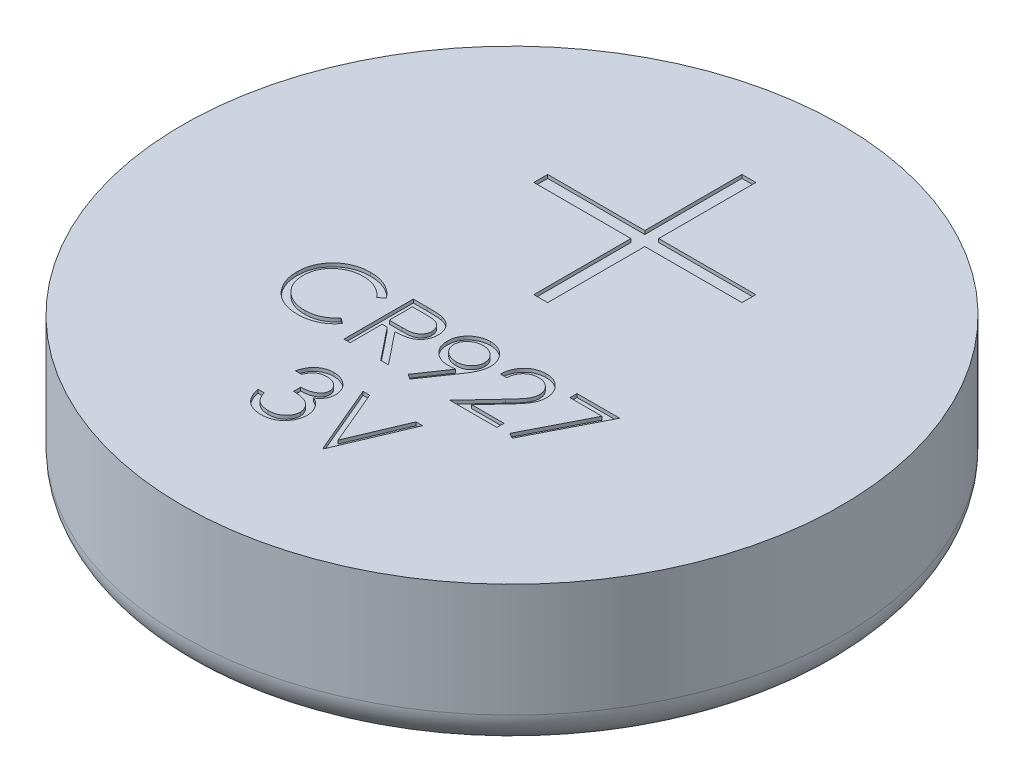
from build123d import *

# Parameters (mm, degrees)
SKETCH1_R           = 4.75
BOSS_EXTRUDE1_DEPTH = 2.7
SKETCH2_R           = 4.75
SKETCH2_R_2         = 3.6449
CUT_EXTRUDE1_DEPTH  = 0.5664
FILLET1_R           = 0.5
FILLET2_R           = 0.2
SKETCH3_R           = 4.25
SKETCH3_R_2         = 3.6449
CUT_EXTRUDE2_DEPTH  = 0.15
CUT_EXTRUDE4_DEPTH  = 0.05
SKETCH6_W           = 1.4
SKETCH6_H           = 0.2
SKETCH6_W_2         = 0.2
SKETCH6_H_2         = 1.4
CUT_EXTRUDE5_DEPTH  = 0.05


with BuildPart() as part:
    # Sketch1 → Boss-Extrude1 (new body)
    with BuildSketch(Plane(origin=(0, 0, 0), x_dir=(1, 0, 0), z_dir=(0, 1, 0))):
        with Locations(Location((0, 0, 0), (0, 0, 90))):
            Circle(SKETCH1_R)
    extrude(amount=BOSS_EXTRUDE1_DEPTH)

    # Sketch2 → Cut-Extrude1 (cut)
    with BuildSketch(Plane.XZ):
        with Locations(Location((0, 0, 0), (0, 0, 270))):
            Circle(SKETCH2_R)
        with Locations(Location((0, 0, 0), (0, 0, 270))):
            Circle(SKETCH2_R_2, mode=Mode.SUBTRACT)
    extrude(amount=-CUT_EXTRUDE1_DEPTH, mode=Mode.SUBTRACT)

    # Fillet1
    fillet1_edges = [part.edges().sort_by_distance(p)[0] for p in [
        (0, 0.5664, 4.75),
    ]]
    fillet(fillet1_edges, radius=FILLET1_R)

    # Fillet2
    fillet2_edges = [part.edges().sort_by_distance(p)[0] for p in [
        (0, 0, 3.6449),
    ]]
    fillet(fillet2_edges, radius=FILLET2_R)

    # Sketch3 → Cut-Extrude2 (cut)
    with BuildSketch(Plane.XZ.offset(-0.5664)):
        with Locations(Location((0, 0, 0), (0, 0, 270))):
            Circle(SKETCH3_R)
        with Locations(Location((0, 0, 0), (0, 0, 270))):
            Circle(SKETCH3_R_2, mode=Mode.SUBTRACT)
    extrude(amount=-CUT_EXTRUDE2_DEPTH, mode=Mode.SUBTRACT)

    # Sketch5 → Cut-Extrude4 (cut)
    # profile 1 of 7: a face of its own
    with BuildSketch(Plane(origin=(0, 2.7, 0), x_dir=(1, 0, 0), z_dir=(0, 1, 0))):
        with BuildLine():
            Line((-1.118097587, -0.693010986), (-1.196623228, -0.75310714))
            add(Edge.make_bspline(
                [(-1.196623228, -0.75310714), (-1.20222491, -0.746431149), (-1.213352752, -0.733169173), (-1.231255381, -0.714546446), (-1.249912994, -0.697099228), (-1.269318457, -0.680744405), (-1.289821062, -0.666053901), (-1.310924148, -0.652262157), (-1.332980732, -0.639899946), (-1.363481228, -0.624910522), (-1.403380613, -0.609268763), (-1.45360771, -0.596153554), (-1.506039452, -0.587804647), (-1.541810195, -0.586900407), (-1.560004638, -0.586440473)],
                knots=[0, 0, 0, 0, 0.757959112, 1.505699292, 2.245454638, 2.979532153, 3.711538275, 4.438200793, 5.171680507, 5.909471876, 7.393775596, 8.890124382, 10.418191784, 12, 12, 12, 12], degree=3))
            add(Edge.make_bspline(
                [(-1.560004638, -0.586440473), (-1.570028438, -0.586555891), (-1.589983007, -0.586785656), (-1.619596857, -0.589816834), (-1.648657728, -0.59407718), (-1.677146719, -0.600398701), (-1.705027564, -0.608390878), (-1.732482536, -0.617940996), (-1.759114136, -0.629756665), (-1.785290776, -0.642816168), (-1.81037055, -0.657566866), (-1.834100564, -0.673656395), (-1.856394269, -0.690904708), (-1.877269301, -0.709376453), (-1.896747, -0.728988442), (-1.914686232, -0.749949682), (-1.931024921, -0.77219316), (-1.946086928, -0.795425563), (-1.95957628, -0.819579217), (-1.970870532, -0.844743523), (-1.980871995, -0.870487553), (-1.988786064, -0.89710217), (-1.995050212, -0.924400103), (-1.999372402, -0.952454614), (-2.002369108, -0.981207094), (-2.00259773, -1.000695469), (-2.002712971, -1.010518999)],
                knots=[0, 0, 0, 0, 1.054917814, 2.100044995, 3.131103042, 4.146048494, 5.169673617, 6.183595914, 7.203665975, 8.234915748, 9.262203917, 10.264457458, 11.251630812, 12.227803204, 13.197192746, 14.159520551, 15.12972552, 16.100847026, 17.073214652, 18.039054194, 19.002613845, 19.979014051, 20.95965708, 21.949030935, 22.966165397, 24, 24, 24, 24], degree=3))
            add(Edge.make_bspline(
                [(-2.002712971, -1.010518999), (-2.002352452, -1.025299376), (-2.001644619, -1.054318686), (-1.995345095, -1.096824575), (-1.985772212, -1.137544767), (-1.971424904, -1.176224722), (-1.953733747, -1.213341396), (-1.931379286, -1.248266783), (-1.905488847, -1.281528658), (-1.875696156, -1.312340929), (-1.84300878, -1.340487708), (-1.807937948, -1.365273588), (-1.770571009, -1.385934983), (-1.731320543, -1.403128111), (-1.68988451, -1.416344319), (-1.646337424, -1.425648354), (-1.600773997, -1.431717548), (-1.569639882, -1.432298602), (-1.553794702, -1.43259432)],
                knots=[0, 0, 0, 0, 1.029171465, 2.020641659, 2.987623507, 3.938342917, 4.889210282, 5.84687017, 6.821220943, 7.821438502, 8.827599549, 9.822697543, 10.807740252, 11.797342354, 12.80366471, 13.83203677, 14.896651826, 16, 16, 16, 16], degree=3))
            add(Edge.make_bspline(
                [(-1.553794702, -1.43259432), (-1.536336791, -1.432111811), (-1.501975446, -1.431162119), (-1.451584581, -1.423116619), (-1.403345791, -1.4100715), (-1.35725648, -1.39181495), (-1.313446581, -1.368082011), (-1.271847536, -1.339311189), (-1.23242423, -1.305228808), (-1.208718149, -1.279205057), (-1.196623228, -1.265927653)],
                knots=[0, 0, 0, 0, 1.028121516, 2.023589091, 2.998037872, 3.967518031, 4.937445131, 5.927275754, 6.942489185, 8, 8, 8, 8], degree=3))
            Line((-1.196623228, -1.265927653), (-1.118097587, -1.325422845))
            add(Edge.make_bspline(
                [(-1.118097587, -1.325422845), (-1.124417047, -1.333576689), (-1.137025697, -1.349845319), (-1.157442273, -1.372780093), (-1.178950072, -1.394352675), (-1.201708847, -1.414389138), (-1.225456787, -1.433290414), (-1.250620305, -1.450519508), (-1.2768686, -1.466316904), (-1.304112737, -1.48078174), (-1.332323769, -1.493615239), (-1.361467893, -1.504602029), (-1.391419486, -1.514066284), (-1.422179917, -1.521852551), (-1.453812991, -1.527930004), (-1.486204555, -1.531992768), (-1.519424519, -1.534776172), (-1.541836354, -1.535029862), (-1.553193741, -1.535158422)],
                knots=[0, 0, 0, 0, 0.986787822, 1.968848986, 2.935600012, 3.899624008, 4.868462664, 5.837806735, 6.815139263, 7.798259679, 8.787526145, 9.778297419, 10.776456485, 11.791383307, 12.812564526, 13.85620153, 14.913611965, 16, 16, 16, 16], degree=3))
            add(Edge.make_bspline(
                [(-1.553193741, -1.535158422), (-1.563949074, -1.535083567), (-1.585216414, -1.534935551), (-1.616616057, -1.532537788), (-1.647184509, -1.529266435), (-1.676834402, -1.524340683), (-1.705727538, -1.518528015), (-1.733601991, -1.510736227), (-1.760732051, -1.502007894), (-1.787008719, -1.491749326), (-1.812454348, -1.480173274), (-1.836986866, -1.467089971), (-1.860594989, -1.452609439), (-1.883510824, -1.437050864), (-1.905395848, -1.419914492), (-1.926439712, -1.401438311), (-1.946760419, -1.381684594), (-1.959332615, -1.36744035), (-1.965653677, -1.360278614)],
                knots=[0, 0, 0, 0, 1.114604814, 2.203992996, 3.262667896, 4.300477797, 5.318619304, 6.316056647, 7.298880507, 8.271930387, 9.238335007, 10.195173496, 11.151986948, 12.108099108, 13.064862484, 14.031167946, 15.010108607, 16, 16, 16, 16], degree=3))
            add(Edge.make_bspline(
                [(-1.965653677, -1.360278614), (-1.975778146, -1.347838275), (-1.995904854, -1.323107786), (-2.021655049, -1.283026077), (-2.043697208, -1.241178017), (-2.061518899, -1.197343752), (-2.075451109, -1.151621641), (-2.085102879, -1.103988637), (-2.091374766, -1.054489225), (-2.092091991, -1.020821571), (-2.092456561, -1.003708102)],
                knots=[0, 0, 0, 0, 0.994628077, 1.977248131, 2.950237994, 3.925870899, 4.908910175, 5.911660606, 6.938484602, 8, 8, 8, 8], degree=3))
            add(Edge.make_bspline(
                [(-2.092456561, -1.003708102), (-2.09201222, -0.985720829), (-2.091138007, -0.950331994), (-2.083710637, -0.898396578), (-2.071762409, -0.848639036), (-2.05479187, -0.801152252), (-2.033276055, -0.755686457), (-2.006697023, -0.71258897), (-1.975363553, -0.67158417), (-1.939521391, -0.633294241), (-1.900216438, -0.598282998), (-1.858125348, -0.567481225), (-1.813330506, -0.541847649), (-1.766325406, -0.520420174), (-1.716758068, -0.503950328), (-1.664734249, -0.492420846), (-1.610351702, -0.485244527), (-1.573248151, -0.484337325), (-1.554395664, -0.483876371)],
                knots=[0, 0, 0, 0, 1.032925535, 2.032216505, 3.007276963, 3.968222605, 4.92396291, 5.891752235, 6.871517503, 7.883894988, 8.900124299, 9.891468569, 10.874487609, 11.85992873, 12.854644235, 13.869047385, 14.917252991, 16, 16, 16, 16], degree=3))
            add(Edge.make_bspline(
                [(-1.554395664, -0.483876371), (-1.542905815, -0.484014125), (-1.520162815, -0.484286794), (-1.4865192, -0.486945692), (-1.45376425, -0.491378151), (-1.421875398, -0.497411314), (-1.390697507, -0.50489912), (-1.360468867, -0.514653491), (-1.3310121, -0.525806785), (-1.302512983, -0.538652061), (-1.275108254, -0.55307113), (-1.248806449, -0.568904166), (-1.223816489, -0.586131539), (-1.199962533, -0.604606732), (-1.177643615, -0.624720606), (-1.15622605, -0.645919919), (-1.13643717, -0.668815297), (-1.124221972, -0.684930993), (-1.118097587, -0.693010986)],
                knots=[0, 0, 0, 0, 1.096760587, 2.17092713, 3.219439832, 4.250915756, 5.268269357, 6.278326846, 7.281116186, 8.274029601, 9.260640565, 10.235837813, 11.203064059, 12.156899882, 13.114053108, 14.069676657, 15.032185724, 16, 16, 16, 16], degree=3))
        make_face()
    # profile 2 of 7: a face of its own
    with BuildSketch(Plane(origin=(0, 2.7, 0), x_dir=(1, 0, 0), z_dir=(0, 1, 0))):
        with BuildLine():
            Line((-0.912969382, -0.509517396), (-0.712849189, -0.509517396))
            add(Edge.make_bspline(
                [(-0.712849189, -0.509517396), (-0.699494581, -0.50956185), (-0.673852254, -0.509647205), (-0.637117034, -0.510123137), (-0.603737864, -0.511487238), (-0.573732195, -0.512661119), (-0.547100579, -0.514801674), (-0.523761354, -0.516847573), (-0.503822011, -0.519525762), (-0.491751768, -0.522013026), (-0.486286689, -0.523139191)],
                knots=[0, 0, 0, 0, 1.410062039, 2.707475311, 3.878576406, 4.937260626, 5.877586885, 6.699081471, 7.410979367, 8, 8, 8, 8], degree=3))
            add(Edge.make_bspline(
                [(-0.486286689, -0.523139191), (-0.478970511, -0.524946839), (-0.464494228, -0.528523571), (-0.443651352, -0.536083457), (-0.423790117, -0.544831921), (-0.404993024, -0.55510727), (-0.387354227, -0.566985778), (-0.370691852, -0.580262385), (-0.354930291, -0.594864443), (-0.340706968, -0.611160112), (-0.327295811, -0.628256258), (-0.315984775, -0.646743046), (-0.306234352, -0.666074911), (-0.298471347, -0.686448459), (-0.292220497, -0.707666108), (-0.287813, -0.72992005), (-0.285169804, -0.7531089), (-0.284900702, -0.768925445), (-0.284764253, -0.776945281)],
                knots=[0, 0, 0, 0, 1.027469482, 2.033020251, 3.019912614, 3.986113645, 4.951240523, 5.91722682, 6.890402269, 7.87763091, 8.8651537, 9.85103654, 10.82876324, 11.815024772, 12.821070561, 13.842952187, 14.906261191, 16, 16, 16, 16], degree=3))
            add(Edge.make_bspline(
                [(-0.284764253, -0.776945281), (-0.285183967, -0.790269597), (-0.286002937, -0.816268787), (-0.293638681, -0.854000468), (-0.306146258, -0.889197415), (-0.323381484, -0.921815311), (-0.345329905, -0.951218353), (-0.371708417, -0.977044197), (-0.402531735, -0.998655601), (-0.431225825, -1.013642117), (-0.456572739, -1.02324009), (-0.4774394, -1.029993336), (-0.500201394, -1.03521104), (-0.524640632, -1.039885364), (-0.550858819, -1.043414419), (-0.578793116, -1.04599916), (-0.608463445, -1.047614603), (-0.628846037, -1.047855176), (-0.639331561, -1.047978935)],
                knots=[0, 0, 0, 0, 1.260483769, 2.459530307, 3.627416485, 4.787058657, 5.939039949, 7.08810263, 8.267026773, 9.491475466, 10.141966685, 10.831826277, 11.566392101, 12.351337768, 13.187381173, 14.07005841, 15.007169909, 16, 16, 16, 16], degree=3))
            Line((-0.639331561, -1.047978935), (-0.271943741, -1.509517396))
            Line((-0.271943741, -1.509517396), (-0.382921305, -1.509517396))
            Line((-0.382921305, -1.509517396), (-0.750309125, -1.047978935))
            Line((-0.750309125, -1.047978935), (-0.823225792, -1.047978935))
            Line((-0.823225792, -1.047978935), (-0.823225792, -1.509517396))
            Line((-0.823225792, -1.509517396), (-0.912969382, -1.509517396))
            Line((-0.912969382, -1.509517396), (-0.912969382, -0.509517396))
        make_face()
        with BuildLine():
            Line((-0.823225792, -0.612081499), (-0.823225792, -0.945414832))
            Line((-0.823225792, -0.945414832), (-0.640132843, -0.946817076))
            add(Edge.make_bspline(
                [(-0.640132843, -0.946817076), (-0.631584261, -0.946820858), (-0.615014673, -0.946828188), (-0.591043054, -0.945687109), (-0.568723022, -0.944389018), (-0.54813995, -0.942403491), (-0.529284643, -0.939844613), (-0.512166525, -0.936643761), (-0.496757653, -0.9329146), (-0.478786642, -0.927142707), (-0.458719062, -0.91799813), (-0.436910073, -0.904693702), (-0.418337977, -0.887959668), (-0.402647159, -0.868824395), (-0.39003875, -0.847785467), (-0.381149592, -0.825095075), (-0.375508894, -0.801326047), (-0.374843595, -0.784989445), (-0.374507843, -0.776744961)],
                knots=[0, 0, 0, 0, 1.146690395, 2.22261258, 3.21895312, 4.145990853, 4.996080663, 5.770904154, 6.481378293, 7.121626537, 8.300444488, 9.431385265, 10.535395872, 11.636531494, 12.74115979, 13.810798291, 14.895190096, 16, 16, 16, 16], degree=3))
            add(Edge.make_bspline(
                [(-0.374507843, -0.776744961), (-0.374851306, -0.768703082), (-0.375531925, -0.752767014), (-0.381088716, -0.729436754), (-0.390485682, -0.707417625), (-0.403149179, -0.686799201), (-0.418577509, -0.668083277), (-0.436668312, -0.652069804), (-0.456926939, -0.638855672), (-0.475861568, -0.630411563), (-0.492785628, -0.625234462), (-0.507479817, -0.621591272), (-0.524083096, -0.618664281), (-0.542676084, -0.616319121), (-0.563179407, -0.614303423), (-0.585696736, -0.612945771), (-0.610078674, -0.61214181), (-0.626977797, -0.612102071), (-0.635725792, -0.612081499)],
                knots=[0, 0, 0, 0, 1.101028733, 2.181837193, 3.264309656, 4.369019818, 5.486613113, 6.575447106, 7.666700264, 8.788928104, 9.402425223, 10.0903467, 10.862060571, 11.710948788, 12.657782767, 13.684531032, 14.801375019, 16, 16, 16, 16], degree=3))
            Line((-0.635725792, -0.612081499), (-0.823225792, -0.612081499))
        make_face(mode=Mode.SUBTRACT)
    # profile 3 of 7: a face of its own
    with BuildSketch(Plane(origin=(0, 2.7, 0), x_dir=(1, 0, 0), z_dir=(0, 1, 0))):
        with BuildLine():
            Line((0.061389593, -1.535158422), (-0.010325151, -1.485278614))
            Line((-0.010325151, -1.485278614), (0.267719721, -1.078828294))
            add(Edge.make_bspline(
                [(0.267719721, -1.078828294), (0.249979511, -1.080997741), (0.215048048, -1.085269502), (0.179866019, -1.08605426), (0.162551452, -1.086440473)],
                knots=[0, 0, 0, 0, 1.015715272, 2, 2, 2, 2], degree=3))
            add(Edge.make_bspline(
                [(0.162551452, -1.086440473), (0.152053724, -1.086171594), (0.131447602, -1.085643808), (0.101152844, -1.081460435), (0.072042684, -1.075017541), (0.044194296, -1.065403611), (0.017503009, -1.053455551), (-0.007972909, -1.038639262), (-0.032199163, -1.021208893), (-0.054915566, -1.001256609), (-0.075576063, -0.979348594), (-0.093982719, -0.956161268), (-0.109280186, -0.931425276), (-0.121987782, -0.905645213), (-0.131625054, -0.878450542), (-0.138642922, -0.850150713), (-0.142963595, -0.820547387), (-0.143477622, -0.800397349), (-0.143738612, -0.790166435)],
                knots=[0, 0, 0, 0, 1.060718605, 2.082097864, 3.085795603, 4.069760067, 5.054557537, 6.03741023, 7.043284206, 8.066802108, 9.088538119, 10.083643548, 11.053783639, 12.022749082, 12.983451788, 13.964007469, 14.966251758, 16, 16, 16, 16], degree=3))
            add(Edge.make_bspline(
                [(-0.143738612, -0.790166435), (-0.14324306, -0.776175391), (-0.14227039, -0.748713811), (-0.134442242, -0.708589877), (-0.12156786, -0.670650864), (-0.103616895, -0.634996523), (-0.081006974, -0.602139741), (-0.053833091, -0.572537281), (-0.02226053, -0.54661018), (0.012991475, -0.5243233), (0.051092338, -0.506399016), (0.090997669, -0.493187787), (0.132401703, -0.485416716), (0.160449609, -0.484392184), (0.174570682, -0.483876371)],
                knots=[0, 0, 0, 0, 1.022988612, 2.007919123, 2.978103895, 3.94594894, 4.918897164, 5.887013414, 6.875921846, 7.89917871, 8.930658928, 9.948724884, 10.967259574, 12, 12, 12, 12], degree=3))
            add(Edge.make_bspline(
                [(0.174570682, -0.483876371), (0.188424517, -0.484399275), (0.215798387, -0.485432483), (0.256052389, -0.492999331), (0.294606965, -0.505752666), (0.33124839, -0.523376827), (0.365173936, -0.545468515), (0.395681311, -0.571792665), (0.422074322, -0.602365673), (0.444309717, -0.636448099), (0.4621583, -0.673067236), (0.475036095, -0.711291214), (0.48296342, -0.750845134), (0.483962371, -0.777643555), (0.484466516, -0.791168037)],
                knots=[0, 0, 0, 0, 1.026385292, 2.028040595, 3.023318987, 4.028184125, 5.03290303, 6.015178782, 7.004435299, 8.016004309, 9.023023918, 10.015172535, 10.998308025, 12, 12, 12, 12], degree=3))
            add(Edge.make_bspline(
                [(0.484466516, -0.791168037), (0.484129828, -0.801666257), (0.48344694, -0.822959268), (0.478665138, -0.855310795), (0.470545085, -0.88829686), (0.461330314, -0.916217316), (0.452435409, -0.939276873), (0.444063657, -0.95749161), (0.43477447, -0.9766634), (0.423940537, -0.996591211), (0.412294166, -1.017529078), (0.399134373, -1.039266997), (0.384761353, -1.061834138), (0.37452429, -1.077047591), (0.369282221, -1.084837909)],
                knots=[0, 0, 0, 0, 1.179839688, 2.393009684, 3.667231171, 4.993948276, 5.694988576, 6.444077775, 7.246288328, 8.089075292, 8.993003841, 9.939041771, 10.944649915, 12, 12, 12, 12], degree=3))
            Line((0.369282221, -1.084837909), (0.061389593, -1.535158422))
        make_face()
        with BuildLine():
            add(Edge.make_bspline(
                [(0.179178054, -0.983876371), (0.18713063, -0.983659118), (0.202611591, -0.983236202), (0.225290819, -0.980662132), (0.246697734, -0.976098136), (0.26688952, -0.969549647), (0.286068634, -0.961647742), (0.303930443, -0.951587174), (0.320489893, -0.939582422), (0.335857872, -0.926093846), (0.349504729, -0.911107965), (0.36165988, -0.895423077), (0.371991471, -0.878970331), (0.380152407, -0.861543685), (0.386862286, -0.84356734), (0.391496004, -0.82475181), (0.394062956, -0.805195124), (0.394500549, -0.791909793), (0.394722926, -0.785158422)],
                knots=[0, 0, 0, 0, 1.163407946, 2.26475976, 3.333800367, 4.359385343, 5.366239384, 6.363380779, 7.350133999, 8.353570782, 9.349036268, 10.310270964, 11.253520213, 12.184142, 13.120487599, 14.056272588, 15.012232024, 16, 16, 16, 16], degree=3))
            add(Edge.make_bspline(
                [(0.394722926, -0.785158422), (0.394531592, -0.778404232), (0.394154545, -0.765094272), (0.391129602, -0.745508632), (0.38580811, -0.726739129), (0.378667971, -0.708683006), (0.369262189, -0.691488614), (0.357975479, -0.674940079), (0.344566207, -0.659142329), (0.329136903, -0.644466905), (0.312498459, -0.630938933), (0.294766888, -0.619000055), (0.27608834, -0.608993999), (0.256576772, -0.60073715), (0.236191529, -0.594293786), (0.214944675, -0.589660253), (0.192728845, -0.587096894), (0.177648478, -0.586662067), (0.169963311, -0.586440473)],
                knots=[0, 0, 0, 0, 0.972161553, 1.915763587, 2.844109794, 3.775983486, 4.705125789, 5.659731448, 6.655561913, 7.682237399, 8.721216875, 9.739758359, 10.754845918, 11.767244016, 12.7857855, 13.828538656, 14.893392813, 16, 16, 16, 16], degree=3))
            add(Edge.make_bspline(
                [(0.169963311, -0.586440473), (0.162344981, -0.586662425), (0.147397881, -0.587097893), (0.12537955, -0.58965538), (0.104276359, -0.594324947), (0.083950182, -0.600734165), (0.064439193, -0.608994614), (0.045761527, -0.619000579), (0.028025808, -0.630936185), (0.011403316, -0.644477549), (-0.004053233, -0.659074019), (-0.017231956, -0.675009285), (-0.028544496, -0.691480006), (-0.037937354, -0.708685294), (-0.045080931, -0.726738518), (-0.050401502, -0.745508797), (-0.053426693, -0.765094229), (-0.053803706, -0.778404218), (-0.053995023, -0.785158422)],
                knots=[0, 0, 0, 0, 1.099389452, 2.15699305, 3.192601482, 4.213358962, 5.227959689, 6.245255729, 7.266013209, 8.307253147, 9.336162325, 10.327954924, 11.284637477, 12.215801273, 13.149702402, 14.080068371, 15.025723358, 16, 16, 16, 16], degree=3))
            add(Edge.make_bspline(
                [(-0.053995023, -0.785158422), (-0.053821901, -0.79191505), (-0.053480473, -0.805240358), (-0.050186819, -0.824819327), (-0.044678739, -0.843587383), (-0.03730177, -0.861727013), (-0.02758703, -0.87906183), (-0.015665931, -0.895509647), (-0.001692918, -0.911256919), (0.014145222, -0.926058979), (0.031478982, -0.939645315), (0.049992338, -0.951511139), (0.069366577, -0.961531837), (0.0896699, -0.969572233), (0.110751843, -0.976032708), (0.132801881, -0.980653721), (0.155747091, -0.983211511), (0.1712928, -0.983652625), (0.179178054, -0.983876371)],
                knots=[0, 0, 0, 0, 0.952633368, 1.87876736, 2.791047057, 3.707742249, 4.635551637, 5.587206343, 6.568248508, 7.601284464, 8.641511608, 9.671105535, 10.699146789, 11.713763218, 12.747829548, 13.806491675, 14.887386225, 16, 16, 16, 16], degree=3))
        make_face(mode=Mode.SUBTRACT)
    # profile 4 of 7: a face of its own
    with BuildSketch(Plane(origin=(0, 2.7, 0), x_dir=(1, 0, 0), z_dir=(0, 1, 0))):
        with BuildLine():
            Line((0.740876772, -0.817209704), (0.651133182, -0.817209704))
            add(Edge.make_bspline(
                [(0.651133182, -0.817209704), (0.651718083, -0.805303736), (0.652866813, -0.781920732), (0.658246324, -0.747828187), (0.665943718, -0.715241102), (0.67682699, -0.684421127), (0.69034307, -0.655095753), (0.706551649, -0.627381463), (0.725749892, -0.60138398), (0.747523245, -0.577344311), (0.771171427, -0.555290719), (0.79668741, -0.536246364), (0.823500275, -0.520155601), (0.851528674, -0.506703818), (0.881088835, -0.496606719), (0.911912509, -0.489114822), (0.94413512, -0.484607294), (0.966089412, -0.484122784), (0.977254977, -0.483876371)],
                knots=[0, 0, 0, 0, 1.10065271, 2.161652631, 3.183658789, 4.190468796, 5.17591951, 6.163126047, 7.15150782, 8.156236427, 9.156009102, 10.134482811, 11.092018607, 12.041330605, 13.001268258, 13.972401359, 14.968799086, 16, 16, 16, 16], degree=3))
            add(Edge.make_bspline(
                [(0.977254977, -0.483876371), (0.988220141, -0.484133073), (1.009766297, -0.484637483), (1.041212587, -0.488969205), (1.071148957, -0.49575366), (1.09951689, -0.50527235), (1.126090051, -0.518067901), (1.151068064, -0.533438626), (1.174748296, -0.551215721), (1.19606452, -0.572145382), (1.215638256, -0.59448892), (1.232524615, -0.618342607), (1.246985519, -0.642979546), (1.259039142, -0.668587604), (1.267912324, -0.695407897), (1.274648955, -0.723049955), (1.278456788, -0.751799901), (1.279041194, -0.771258917), (1.279338311, -0.781152012)],
                knots=[0, 0, 0, 0, 1.111607364, 2.184268762, 3.212621178, 4.221274766, 5.211760367, 6.196651075, 7.1921475, 8.207485113, 9.220403448, 10.201281604, 11.166441695, 12.114753415, 13.065576456, 14.026450734, 14.996634279, 16, 16, 16, 16], degree=3))
            add(Edge.make_bspline(
                [(1.279338311, -0.781152012), (1.278854521, -0.795079965), (1.277895432, -0.822691454), (1.269691325, -0.863267129), (1.256878036, -0.902579535), (1.24145022, -0.934218764), (1.225886664, -0.959714048), (1.211861662, -0.980705106), (1.195443145, -1.003306669), (1.176392145, -1.027443051), (1.155102753, -1.053303309), (1.131382135, -1.080871822), (1.10506114, -1.109863757), (1.086587283, -1.129665357), (1.077014593, -1.13992605)],
                knots=[0, 0, 0, 0, 1.184426356, 2.348067706, 3.509069118, 4.696110526, 5.333549288, 6.050745305, 6.844228056, 7.710549037, 8.667450064, 9.695053472, 10.805634456, 12, 12, 12, 12], degree=3))
            Line((1.077014593, -1.13992605), (0.826814272, -1.406953294))
            Line((0.826814272, -1.406953294), (1.292158823, -1.406953294))
            Line((1.292158823, -1.406953294), (1.292158823, -1.509517396))
            Line((1.292158823, -1.509517396), (0.612671644, -1.509517396))
            Line((0.612671644, -1.509517396), (1.000492157, -1.095655217))
            add(Edge.make_bspline(
                [(1.000492157, -1.095655217), (1.00993441, -1.085798558), (1.028071047, -1.066865933), (1.053723211, -1.039225087), (1.076762922, -1.013582362), (1.09733932, -0.989986205), (1.115006036, -0.968091471), (1.130683817, -0.94860727), (1.143245414, -0.930677427), (1.156878384, -0.909894395), (1.170082379, -0.884519447), (1.181428766, -0.853509821), (1.188347294, -0.821587749), (1.189177247, -0.800015739), (1.189594721, -0.789164832)],
                knots=[0, 0, 0, 0, 1.329631726, 2.553950428, 3.673215718, 4.687767853, 5.603093632, 6.413772471, 7.123043292, 7.734684054, 8.834405432, 9.900288307, 10.943827018, 12, 12, 12, 12], degree=3))
            add(Edge.make_bspline(
                [(1.189594721, -0.789164832), (1.18941308, -0.782341576), (1.189055101, -0.768894247), (1.185895759, -0.749178316), (1.181121329, -0.730159798), (1.174279827, -0.711780192), (1.165249329, -0.694224292), (1.154256935, -0.677470726), (1.14157406, -0.661273879), (1.126902269, -0.646087222), (1.110784692, -0.632178306), (1.093757763, -0.619857139), (1.075743448, -0.60956025), (1.056817698, -0.601119251), (1.037033279, -0.594497713), (1.016351923, -0.589909548), (0.994830775, -0.587028838), (0.980135491, -0.586639075), (0.972647606, -0.586440473)],
                knots=[0, 0, 0, 0, 0.991446411, 1.95395049, 2.89581595, 3.838931463, 4.798493298, 5.75982156, 6.748411868, 7.785213223, 8.824556874, 9.840280684, 10.836137867, 11.835679398, 12.848801643, 13.863922112, 14.911575587, 16, 16, 16, 16], degree=3))
            add(Edge.make_bspline(
                [(0.972647606, -0.586440473), (0.964827368, -0.586644768), (0.949469712, -0.58704597), (0.926921416, -0.589852445), (0.905411194, -0.594694114), (0.884884936, -0.601316021), (0.865307912, -0.609732749), (0.846775328, -0.620216105), (0.829328788, -0.632725674), (0.812935496, -0.64690869), (0.797831502, -0.662699434), (0.784560966, -0.68030228), (0.772965533, -0.699395827), (0.762848609, -0.719928556), (0.754632698, -0.742086779), (0.748354655, -0.765791837), (0.743386984, -0.790940804), (0.741727407, -0.808307971), (0.740876772, -0.817209704)],
                knots=[0, 0, 0, 0, 1.031018746, 2.02475058, 2.990194455, 3.934040569, 4.864654155, 5.795059489, 6.735614925, 7.690564532, 8.649604399, 9.611025574, 10.590972636, 11.591080095, 12.624614302, 13.701020113, 14.821632451, 16, 16, 16, 16], degree=3))
        make_face()
    # profile 5 of 7: a face of its own
    with BuildSketch(Plane(origin=(0, 2.7, 0), x_dir=(1, 0, 0), z_dir=(0, 1, 0))):
        Polygon((1.446004977, -0.509517396), (2.061389593, -0.509517396), (1.535748567, -1.535158422), (1.458224529, -1.492490153), (1.909546644, -0.612081499), (1.446004977, -0.612081499), align=None)
    # profile 6 of 7: a face of its own
    with BuildSketch(Plane(origin=(0, 2.7, 0), x_dir=(1, 0, 0), z_dir=(0, 1, 0))):
        with BuildLine():
            Line((-0.777804448, -2.254340723), (-0.867548038, -2.254340723))
            add(Edge.make_bspline(
                [(-0.867548038, -2.254340723), (-0.865116737, -2.244274299), (-0.860363744, -2.224595264), (-0.850450152, -2.196478904), (-0.839650365, -2.169872183), (-0.826682049, -2.145273305), (-0.812536691, -2.122187904), (-0.796330199, -2.101139583), (-0.778810278, -2.081593021), (-0.759431721, -2.064246382), (-0.739109247, -2.04853846), (-0.717556498, -2.035145586), (-0.6952071, -2.0236244), (-0.671906205, -2.014132905), (-0.647584441, -2.006982755), (-0.622461692, -2.001795096), (-0.59647212, -1.998426207), (-0.578829952, -1.998097417), (-0.569871756, -1.997930467)],
                knots=[0, 0, 0, 0, 1.162005537, 2.271625781, 3.343758855, 4.383309926, 5.390229558, 6.379919256, 7.361854164, 8.333198761, 9.295911338, 10.242430842, 11.177959212, 12.116337295, 13.062827104, 14.020064771, 14.994644689, 16, 16, 16, 16], degree=3))
            add(Edge.make_bspline(
                [(-0.569871756, -1.997930467), (-0.556819544, -1.998324533), (-0.530999826, -1.999104069), (-0.493067527, -2.006222479), (-0.456488436, -2.017486803), (-0.421662936, -2.033050725), (-0.389314813, -2.0522471), (-0.360533045, -2.075094168), (-0.335707756, -2.101151111), (-0.314880791, -2.129931844), (-0.298573649, -2.16069056), (-0.286548971, -2.192347748), (-0.27922849, -2.224828311), (-0.27827976, -2.246758963), (-0.277804448, -2.257746172)],
                knots=[0, 0, 0, 0, 1.083050992, 2.142477498, 3.193116406, 4.255571735, 5.30263384, 6.308962982, 7.297363603, 8.282367274, 9.249857812, 10.179914175, 11.08814088, 12, 12, 12, 12], degree=3))
            add(Edge.make_bspline(
                [(-0.277804448, -2.257746172), (-0.278136902, -2.268319542), (-0.278787464, -2.289009986), (-0.28431138, -2.319216128), (-0.293607455, -2.347685157), (-0.30648453, -2.374536918), (-0.323153545, -2.399601158), (-0.343345744, -2.422934269), (-0.367203647, -2.444639743), (-0.385283344, -2.457073878), (-0.394591307, -2.463475339)],
                knots=[0, 0, 0, 0, 1.024540389, 2.004866551, 2.965041327, 3.920577974, 4.882998113, 5.874504559, 6.905732034, 8, 8, 8, 8], degree=3))
            add(Edge.make_bspline(
                [(-0.394591307, -2.463475339), (-0.383953663, -2.468611959), (-0.362877413, -2.47878909), (-0.33414869, -2.498747878), (-0.308069297, -2.521792549), (-0.293525377, -2.539776164), (-0.286217909, -2.548811877)],
                knots=[0, 0, 0, 0, 1.015518401, 2.012035669, 3.001164323, 4, 4, 4, 4], degree=3))
            add(Edge.make_bspline(
                [(-0.286217909, -2.548811877), (-0.281406097, -2.555399806), (-0.27186127, -2.568467783), (-0.260079689, -2.58947819), (-0.24939137, -2.610721473), (-0.241062736, -2.632767017), (-0.23461306, -2.655359307), (-0.230002765, -2.678537134), (-0.227138725, -2.702319426), (-0.226728567, -2.718408706), (-0.226522397, -2.726496172)],
                knots=[0, 0, 0, 0, 1.025084078, 2.033381695, 3.024893161, 4.013698104, 4.991890475, 5.976764909, 6.982997093, 8, 8, 8, 8], degree=3))
            add(Edge.make_bspline(
                [(-0.226522397, -2.726496172), (-0.227035115, -2.74049895), (-0.228058138, -2.768438607), (-0.237202159, -2.809717099), (-0.251377371, -2.850067243), (-0.271507924, -2.888660054), (-0.296041498, -2.924768734), (-0.325229305, -2.957076251), (-0.358739707, -2.984847281), (-0.39611275, -3.008050203), (-0.436603358, -3.026598181), (-0.47991067, -3.039471736), (-0.525410685, -3.047856307), (-0.556612771, -3.048755413), (-0.572475922, -3.049212518)],
                knots=[0, 0, 0, 0, 0.955779014, 1.907060117, 2.875433937, 3.871313158, 4.872415639, 5.851225146, 6.836215519, 7.83643374, 8.849228613, 9.86973379, 10.916971861, 12, 12, 12, 12], degree=3))
            add(Edge.make_bspline(
                [(-0.572475922, -3.049212518), (-0.583167151, -3.048964457), (-0.604203924, -3.048476356), (-0.635130638, -3.045139613), (-0.664651123, -3.039045326), (-0.692805294, -3.030844381), (-0.719618161, -3.020446741), (-0.745007906, -3.007498541), (-0.769130733, -2.992266684), (-0.791759004, -2.974571373), (-0.812890024, -2.954776704), (-0.831962231, -2.932531273), (-0.8492936, -2.9082463), (-0.864420068, -2.881639713), (-0.878030626, -2.853055354), (-0.889225185, -2.822127211), (-0.899078205, -2.789131776), (-0.903659194, -2.766138136), (-0.906009576, -2.754340723)],
                knots=[0, 0, 0, 0, 1.048658725, 2.063410685, 3.046034179, 4.001477787, 4.936774919, 5.862367409, 6.792675028, 7.730719943, 8.675894397, 9.627829632, 10.600096036, 11.597688215, 12.626045268, 13.701542398, 14.82072376, 16, 16, 16, 16], degree=3))
            Line((-0.906009576, -2.754340723), (-0.816265986, -2.754340723))
            add(Edge.make_bspline(
                [(-0.816265986, -2.754340723), (-0.813927903, -2.762040442), (-0.809380128, -2.777017062), (-0.8016389, -2.798571435), (-0.792819394, -2.818330879), (-0.783358091, -2.836440342), (-0.773421392, -2.853078172), (-0.762302842, -2.86780442), (-0.750825944, -2.881265906), (-0.7421747, -2.888850081), (-0.737940666, -2.892561877)],
                knots=[0, 0, 0, 0, 1.198163088, 2.33053128, 3.407730985, 4.417276592, 5.372219308, 6.28897303, 7.162600585, 8, 8, 8, 8], degree=3))
            add(Edge.make_bspline(
                [(-0.737940666, -2.892561877), (-0.732341644, -2.896878544), (-0.721160883, -2.905498553), (-0.702941389, -2.916499019), (-0.683779992, -2.92603074), (-0.663261514, -2.933311796), (-0.641828723, -2.939476842), (-0.61913519, -2.943511276), (-0.595381128, -2.946279325), (-0.579161767, -2.946523591), (-0.570873358, -2.946648416)],
                knots=[0, 0, 0, 0, 0.946170439, 1.889420265, 2.845303464, 3.807233317, 4.801018734, 5.828864929, 6.890507805, 8, 8, 8, 8], degree=3))
            add(Edge.make_bspline(
                [(-0.570873358, -2.946648416), (-0.561515214, -2.946472443), (-0.543216173, -2.946128343), (-0.516514784, -2.942963855), (-0.491112656, -2.938355166), (-0.46729182, -2.931237171), (-0.444740247, -2.922442642), (-0.423774061, -2.91140024), (-0.404118031, -2.898444605), (-0.386023915, -2.883719131), (-0.36975377, -2.867598704), (-0.355428195, -2.850737827), (-0.34324972, -2.83320759), (-0.333425841, -2.814910984), (-0.325668541, -2.795923776), (-0.320387626, -2.776192682), (-0.316715765, -2.755879177), (-0.316416733, -2.7420709), (-0.316265986, -2.735109954)],
                knots=[0, 0, 0, 0, 1.217147791, 2.380027433, 3.494444702, 4.572153297, 5.609568379, 6.639424714, 7.649109417, 8.668170816, 9.669597737, 10.625200337, 11.543417969, 12.441394052, 13.322311151, 14.205496177, 15.095365482, 16, 16, 16, 16], degree=3))
            add(Edge.make_bspline(
                [(-0.316265986, -2.735109954), (-0.316703215, -2.725792429), (-0.317575498, -2.707203741), (-0.324235092, -2.679855862), (-0.335189053, -2.653506316), (-0.350524056, -2.628604662), (-0.369191407, -2.605525833), (-0.391009952, -2.584933981), (-0.416160875, -2.567942526), (-0.439309409, -2.55620291), (-0.459813739, -2.548192317), (-0.477360992, -2.542856613), (-0.497005736, -2.538338425), (-0.518510407, -2.534134919), (-0.54203704, -2.530557391), (-0.567560022, -2.527574015), (-0.595084525, -2.525186861), (-0.614139144, -2.524120834), (-0.623958294, -2.523571493)],
                knots=[0, 0, 0, 0, 1.07054697, 2.135767047, 3.216561865, 4.33974944, 5.486079747, 6.621378074, 7.775625952, 8.963672916, 9.598146892, 10.304877434, 11.070270905, 11.915000392, 12.823868403, 13.805723172, 14.86925407, 16, 16, 16, 16], degree=3))
            Line((-0.623958294, -2.523571493), (-0.623958294, -2.42100739))
            add(Edge.make_bspline(
                [(-0.623958294, -2.42100739), (-0.611586532, -2.420797446), (-0.587353291, -2.420386218), (-0.551954918, -2.4154125), (-0.5181054, -2.408532321), (-0.486554902, -2.397993695), (-0.457798127, -2.38575361), (-0.432849669, -2.371510121), (-0.412059056, -2.355677336), (-0.395527321, -2.338010876), (-0.383090399, -2.31906372), (-0.373997028, -2.299316103), (-0.368625506, -2.278594943), (-0.367908458, -2.264453609), (-0.367548038, -2.257345531)],
                knots=[0, 0, 0, 0, 1.321986639, 2.589447074, 3.816329219, 5.01088745, 6.139805852, 7.153945165, 8.075214402, 8.924034688, 9.728124013, 10.488707548, 11.240355623, 12, 12, 12, 12], degree=3))
            add(Edge.make_bspline(
                [(-0.367548038, -2.257345531), (-0.367666441, -2.252123318), (-0.367901998, -2.241733973), (-0.370872649, -2.226555382), (-0.375336661, -2.211840826), (-0.381473726, -2.197652881), (-0.389688069, -2.184089945), (-0.399518351, -2.171036388), (-0.411223522, -2.158566737), (-0.424636507, -2.146943789), (-0.43903988, -2.135866864), (-0.45482553, -2.126462968), (-0.471517494, -2.118421521), (-0.489134252, -2.111790235), (-0.507732975, -2.106801867), (-0.527226278, -2.103220198), (-0.54765133, -2.100980868), (-0.561586111, -2.100658463), (-0.568669832, -2.10049457)],
                knots=[0, 0, 0, 0, 0.884392785, 1.759457502, 2.611959086, 3.489218968, 4.37281399, 5.2945488, 6.255912374, 7.266815255, 8.301784654, 9.332968512, 10.37626691, 11.440494194, 12.520033166, 13.637162961, 14.798855837, 16, 16, 16, 16], degree=3))
            add(Edge.make_bspline(
                [(-0.568669832, -2.10049457), (-0.580056023, -2.100892102), (-0.602295902, -2.101668574), (-0.634357307, -2.108469435), (-0.664162831, -2.119320316), (-0.686945307, -2.132272607), (-0.7037689, -2.145058446), (-0.715790882, -2.156224842), (-0.727596742, -2.16863422), (-0.738409793, -2.183050899), (-0.749345215, -2.198498553), (-0.759300804, -2.215762462), (-0.768975002, -2.234392289), (-0.774804301, -2.24756247), (-0.777804448, -2.254340723)],
                knots=[0, 0, 0, 0, 1.472543308, 2.876219568, 4.221790263, 5.565193594, 6.249813518, 6.953379497, 7.687249741, 8.463570142, 9.283606569, 10.136032583, 11.040678096, 12, 12, 12, 12], degree=3))
        make_face()
    # profile 7 of 7: a face of its own
    with BuildSketch(Plane(origin=(0, 2.7, 0), x_dir=(1, 0, 0), z_dir=(0, 1, 0))):
        Polygon((-0.123958294, -2.023571493), (-0.027804448, -2.023571493), (0.305528885, -2.81163239), (0.638862219, -2.023571493), (0.735016065, -2.023571493), (0.311939142, -3.023571493), (0.299118629, -3.023571493), align=None)
    extrude(amount=-CUT_EXTRUDE4_DEPTH, mode=Mode.SUBTRACT)

    # Sketch6 → Cut-Extrude5 (cut)
    with BuildSketch(Plane(origin=(0, 2.7, 0), x_dir=(1, 0, 0), z_dir=(0, 1, 0))):
        with Locations((0.8, 1.914362761)):
            Rectangle(SKETCH6_W, SKETCH6_H)
        with Locations((0, 1.914362761)):
            Rectangle(SKETCH6_W_2, SKETCH6_H)
        with Locations((0, 1.114362761)):
            Rectangle(SKETCH6_W_2, SKETCH6_H_2)
        with Locations((-0.8, 1.914362761)):
            Rectangle(SKETCH6_W, SKETCH6_H)
        with Locations((0, 2.714362761)):
            Rectangle(SKETCH6_W_2, SKETCH6_H_2)
    extrude(amount=-CUT_EXTRUDE5_DEPTH, mode=Mode.SUBTRACT)


solid = part.part
